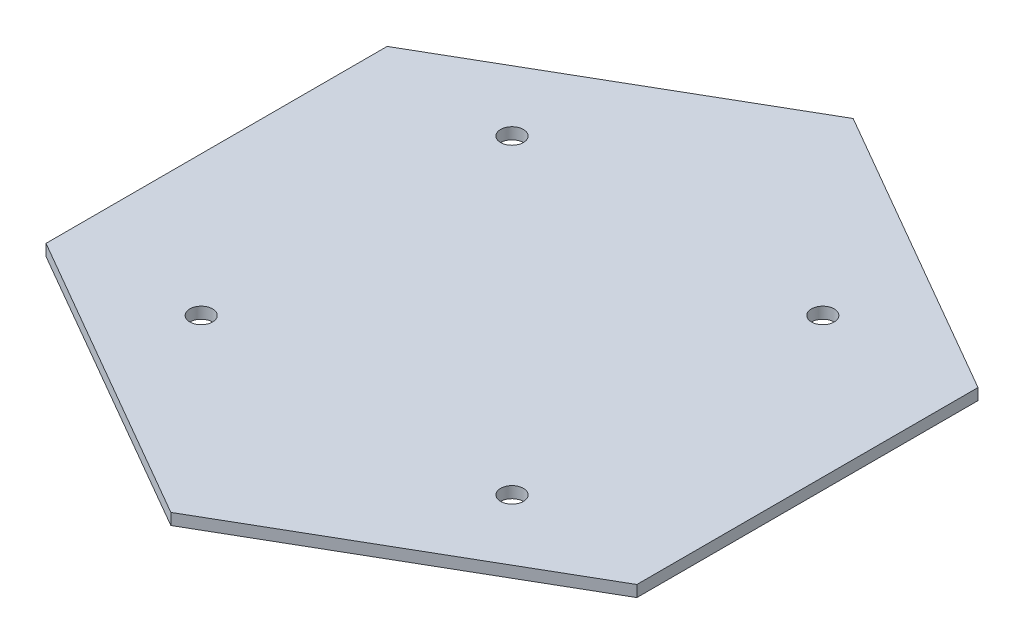
from build123d import *

# Parameters (mm, degrees)
BOSS_EXTRUDE1_DEPTH = 1.5
SKETCH2_R           = 1.5
CUT_EXTRUDE1_DEPTH  = 1.5


with BuildPart() as part:
    # Sketch1 → Boss-Extrude1 (new body)
    with BuildSketch(Plane(origin=(0, 0, 0), x_dir=(1, 0, 0), z_dir=(0, 1, 0))):
        Polygon((0, -45), (38.97114317, -22.5), (38.97114317, 22.5), (0, 45), (-38.97114317, 22.5), (-38.97114317, -22.5), align=None)
    extrude(amount=BOSS_EXTRUDE1_DEPTH)

    # Sketch2 → Cut-Extrude1 (cut)
    with BuildSketch(Plane(origin=(0, 1.5, 0), x_dir=(1, 0, 0), z_dir=(0, 1, 0))):
        with Locations(Location((20.5, 20.5, 0), (0, 0, 270))):
            Circle(SKETCH2_R)
        with Locations(Location((20.5, -20.5, 0), (0, 0, 90))):
            Circle(SKETCH2_R)
        with Locations(Location((-20.5, -20.5, 0), (0, 0, 270))):
            Circle(SKETCH2_R)
        with Locations(Location((-20.5, 20.5, 0), (0, 0, 90))):
            Circle(SKETCH2_R)
    extrude(amount=-CUT_EXTRUDE1_DEPTH, mode=Mode.SUBTRACT)


solid = part.part
